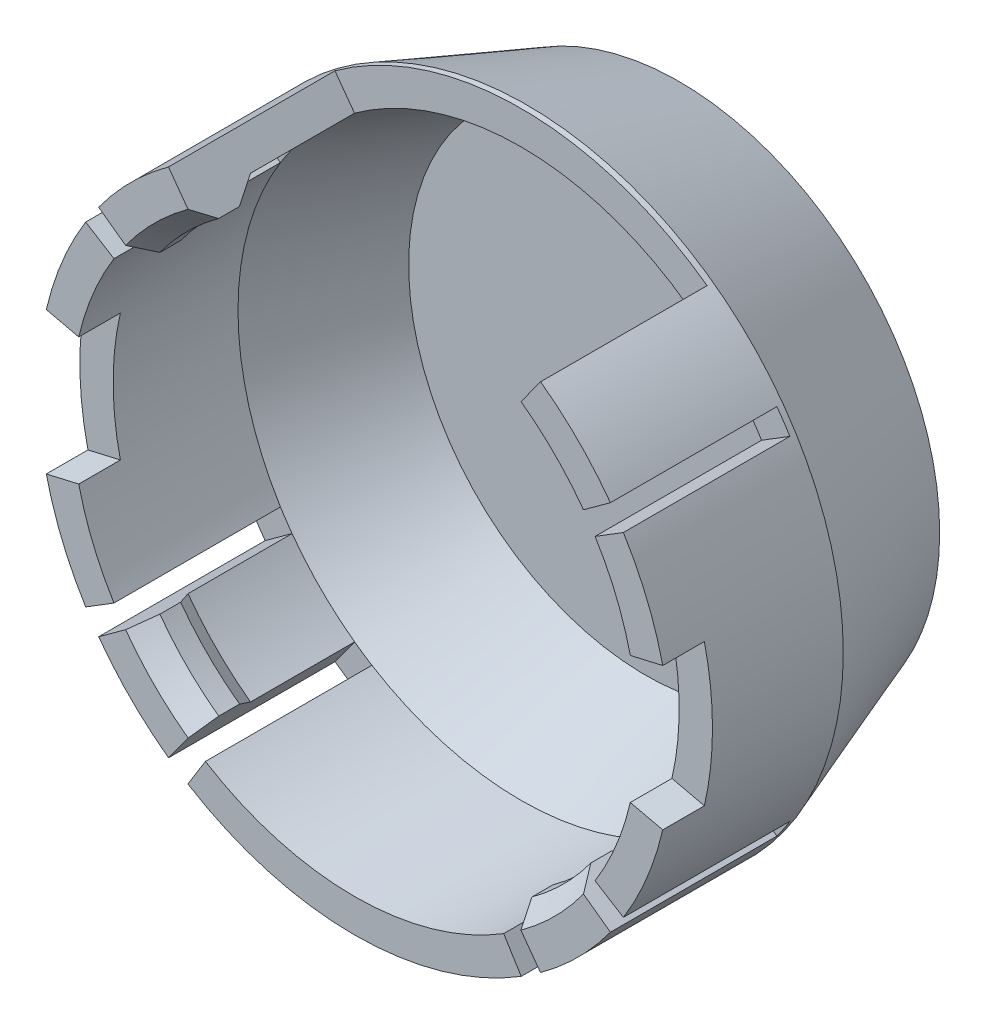
from build123d import *

# Parameters (mm, degrees)
CUT_EXTRUDE1_DEPTH = 8
CUT_EXTRUDE2_START = -8
CUT_EXTRUDE2_DEPTH = 8
CIRPATTERN1_COUNT  = 4
CUT_EXTRUDE3_START = -2
CUT_EXTRUDE3_DEPTH = 2


with BuildPart() as part:
    # Sketch1 → Revolve1 (revolve)
    with BuildSketch(Plane(origin=(0, 0, 0), x_dir=(0, 0, -1), z_dir=(1, 0, 0)), mode=Mode.PRIVATE) as revolve1_sk:
        Polygon((0, 15.2), (8.284085908, 15.2), (15.6, 12.517498166), (15.6, 0), (14, 0), (14, 11.4), (8, 13.6), (3, 13.6), (2, 12.8), (1, 12.8), (0, 13.6), align=None)
    revolve(revolve1_sk.sketch.rotate(Axis((0, 0, -14), (0, 0, -1)), 90), axis=Axis((0, 0, -14), (0, 0, -1)))

    # Sketch2 → Cut-Extrude1 (cut)
    with BuildSketch(Plane.XY):
        Polygon((-11.056373105, 15.2), (11.056373105, 15.2), (7.529411765, 10.351229805), (-7.529411765, 10.351229805), align=None)
    extrude(amount=-CUT_EXTRUDE1_DEPTH, mode=Mode.SUBTRACT)

    # Sketch3 → Cut-Extrude2 (cut)
    with BuildSketch(Plane.XY.offset(CUT_EXTRUDE2_START)):
        with BuildLine():
            Line((-8.936632298, 12.295389509), (-7.525585093, 10.354012218))
            Line((-7.525585093, 10.354012218), (-10.354012218, 7.525585093))
            Line((-10.354012218, 7.525585093), (-12.295389509, 8.936632298))
            ThreePointArc((-12.295389509, 8.936632298), (-12.615841165, 8.478239894), (-12.919211808, 8.008368514))
            Line((-12.919211808, 8.008368514), (-11.559294775, 7.165382355))
            ThreePointArc((-11.559294775, 7.165382355), (-13.079877846, 3.725157114), (-13.6, 0))
            Line((-13.6, 0), (0, 0))
            Line((0, 0), (0, 13.6))
            ThreePointArc((0, 13.6), (-3.725483093, 13.079785003), (-7.165958512, 11.558937607))
            Line((-7.165958512, 11.558937607), (-8.009012455, 12.918812619))
            ThreePointArc((-8.009012455, 12.918812619), (-8.478554306, 12.615629865), (-8.936632298, 12.295389509))
        make_face()
    cut_extrude2 = extrude(amount=CUT_EXTRUDE2_DEPTH, mode=Mode.SUBTRACT)

    # CirPattern1: Cut-Extrude2 ×4 about axis
    cirpattern1_axis = Axis((0, 0, 0), (0, 0, 1))
    for i in range(1, CIRPATTERN1_COUNT):
        add(cut_extrude2.rotate(cirpattern1_axis, i * 360 / CIRPATTERN1_COUNT), mode=Mode.SUBTRACT)

    # Sketch4 → Cut-Extrude3 (cut)
    with BuildSketch(Plane.XY.offset(CUT_EXTRUDE3_START)):
        with BuildLine():
            Line((-14.810424985, -3.419256026), (0, 0))
            Line((0, 0), (-14.810424985, 3.419256026))
            ThreePointArc((-14.810424985, 3.419256026), (-15.2, 0), (-14.810424985, -3.419256026))
        make_face()
        with BuildLine():
            Line((14.810424985, 3.419256026), (0, 0))
            Line((0, 0), (14.810424985, -3.419256026))
            ThreePointArc((14.810424985, -3.419256026), (15.2, 0), (14.810424985, 3.419256026))
        make_face()
    extrude(amount=CUT_EXTRUDE3_DEPTH, mode=Mode.SUBTRACT)


solid = part.part
